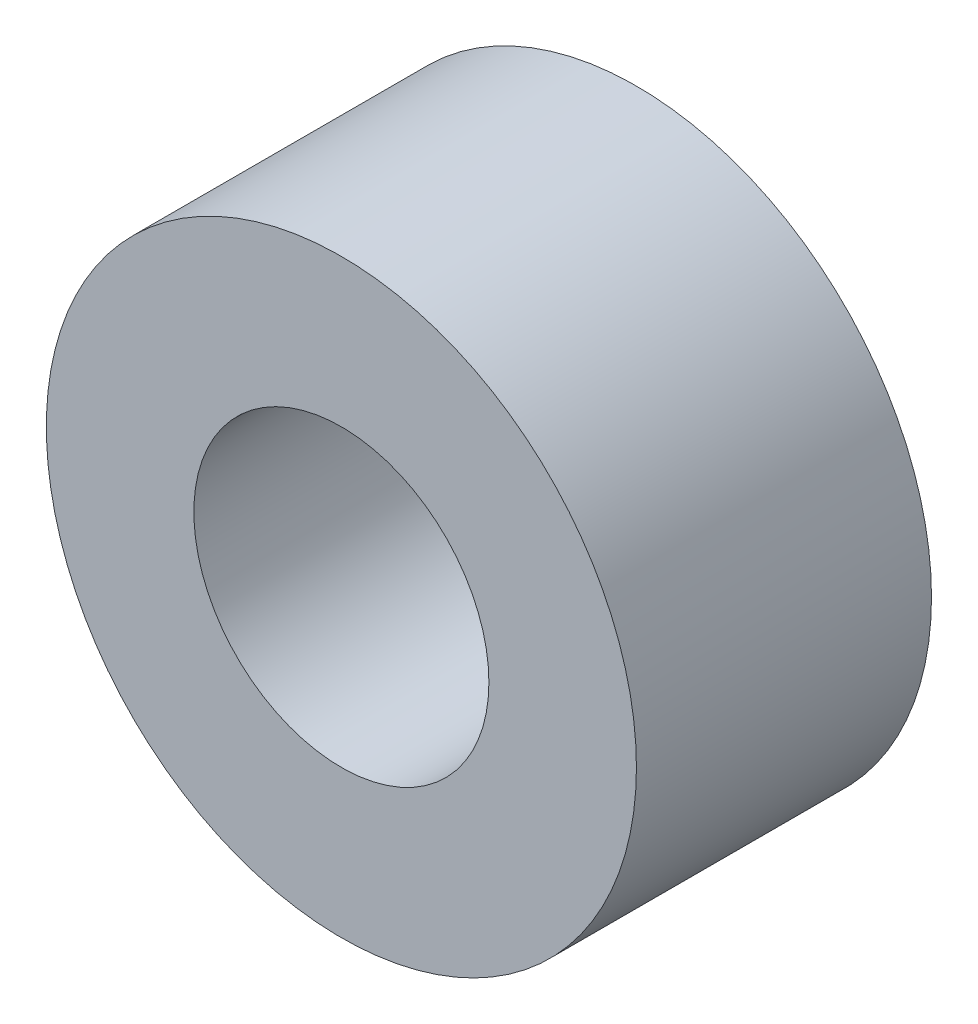
from build123d import *

# Parameters (mm, degrees)
SKETCH1_R             = 8
SKETCH1_R_2           = 4
WASHER_ENVELOPE_DEPTH = 8


with BuildPart() as part:
    # Sketch1 → Washer_Envelope (new body)
    with BuildSketch(Plane.XY):
        Circle(SKETCH1_R)
        Circle(SKETCH1_R_2, mode=Mode.SUBTRACT)
    extrude(amount=WASHER_ENVELOPE_DEPTH)


solid = part.part
